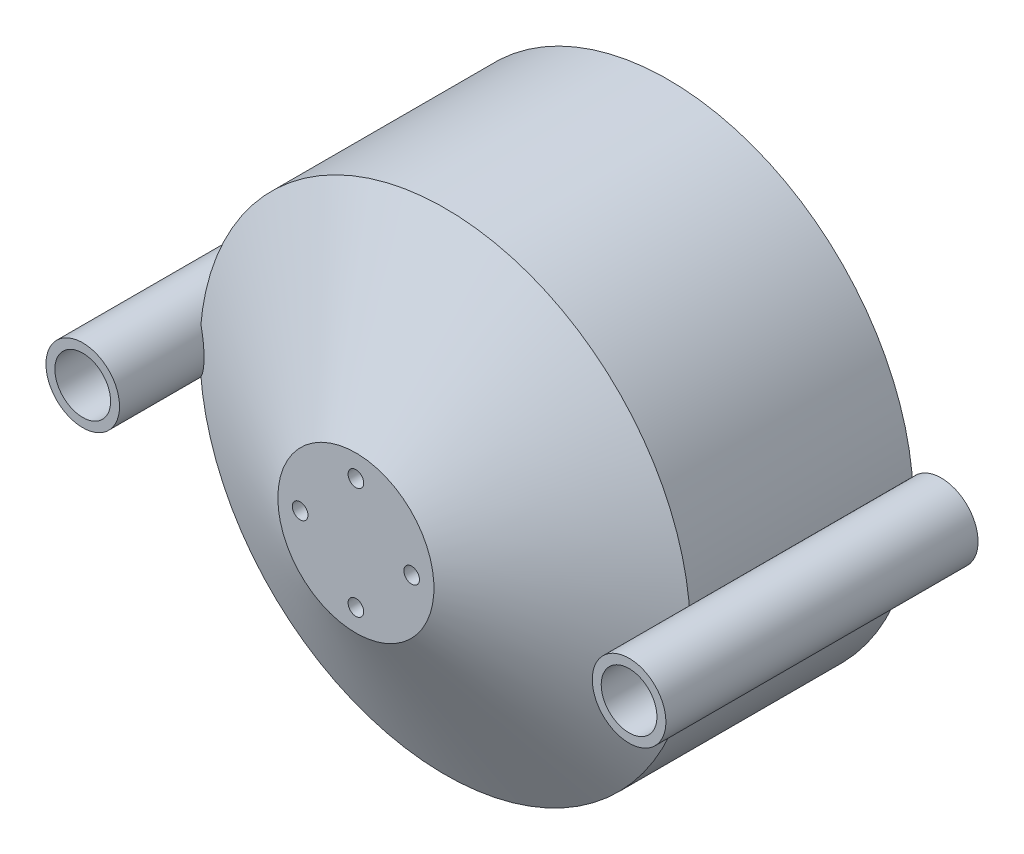
from build123d import *

# Parameters (mm, degrees)
SKETCH3_R             = 1.75
CUT_EXTRUDE1_DEPTH    = 105.642247682
SKETCH4_R             = 8.25
SKETCH4_R_2           = 6.25
BOSS_EXTRUDE1_DEPTH   = 70
BOSS_EXTRUDE1_2_DEPTH = 70


with BuildPart() as part:
    # Sketch2 → Revolve1 (revolve)
    with BuildSketch(Plane(origin=(0, 0, 0), x_dir=(1, 0, 0), z_dir=(0, 1, 0))):
        Polygon((0, 0), (-17.5, 0), (-55, 20), (-55, 70), (-52.5, 70), (-52.5, 21.5), (-23.4375, 6), (-15, 6), (0, 6), align=None)
    revolve(axis=Axis((0, 0, -52.255434783), (0, 0, 1)))

    # Sketch3 → Cut-Extrude1 (cut, through all)
    with BuildSketch(Plane.XY):
        with Locations((0, 12.5)):
            Circle(SKETCH3_R)
        with Locations((12.5, 0)):
            Circle(SKETCH3_R)
        with Locations((0, -12.5)):
            Circle(SKETCH3_R)
        with Locations((-12.5, 0)):
            Circle(SKETCH3_R)
    extrude(amount=-CUT_EXTRUDE1_DEPTH, mode=Mode.SUBTRACT)


with BuildPart() as body_2:
    # Sketch4 → Boss-Extrude1 (new body)
    with BuildSketch(Plane.XY):
        with Locations((-61.25, 0)):
            Circle(SKETCH4_R)
        with Locations((-61.25, 0)):
            Circle(SKETCH4_R_2, mode=Mode.SUBTRACT)
    extrude(amount=-BOSS_EXTRUDE1_DEPTH)


with BuildPart() as body_3:
    # Sketch4 → Boss-Extrude1 2 (new body)
    with BuildSketch(Plane.XY):
        with Locations(Location((61.25, 0, 0), (0, 0, 180))):
            Circle(SKETCH4_R)
        with Locations(Location((61.25, 0, 0), (0, 0, 180))):
            Circle(SKETCH4_R_2, mode=Mode.SUBTRACT)
    extrude(amount=-BOSS_EXTRUDE1_2_DEPTH)


solid = Compound([part.part, body_2.part, body_3.part])
